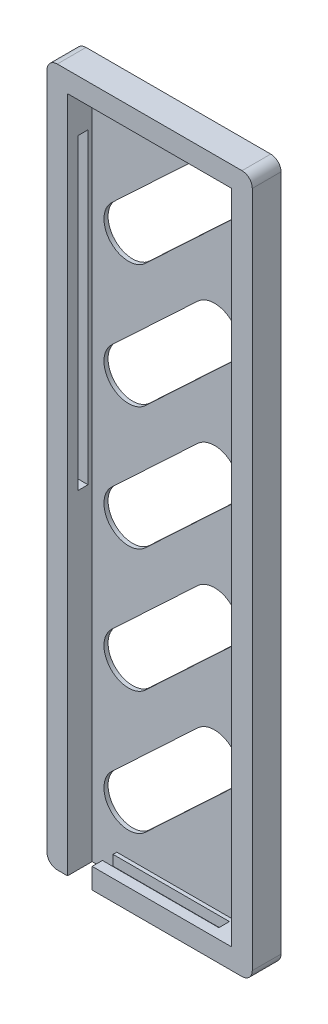
from build123d import *

# Parameters (mm, degrees)
SKETCH_1_W           = 10
SKETCH_1_H           = 34
EXTRUDE_2_DEPTH      = 1.4
SKETCH_2_W           = 8
SKETCH_2_H           = 32
CUT_EXTRUDE_1_DEPTH  = 1.2
SKETCH_4_W           = 1.2
SKETCH_4_H           = 1
CUT_EXTRUDE_4_DEPTH  = 1.2
FILLET_1_R           = 0.5
FILLET_2_R           = 0.5
SKETCH_6_W           = 6.011424245
SKETCH_6_H           = 0.514664245
CUT_EXTRUDE_6_DEPTH  = 0.5
SKETCH_7_W           = 0.498386998
SKETCH_7_H           = 14.972688723
CUT_EXTRUDE_7_DEPTH  = 0.5
SKETCH_8_W           = 0.497690278
SKETCH_8_H           = 27.903913782
CUT_EXTRUDE_8_DEPTH  = 0.5
SKETCH_10_W          = 5.67106867
SKETCH_10_H          = 0.515598409
CUT_EXTRUDE_9_DEPTH  = 0.5
CUT_EXTRUDE_11_REACH = 22.554


with BuildPart() as part:
    # 草图1 → 凸台-拉伸2 (new body)
    with BuildSketch(Plane.XY):
        with Locations((3.178294574, 1.80536099)):
            Rectangle(SKETCH_1_W, SKETCH_1_H)
    extrude(amount=EXTRUDE_2_DEPTH)

    # 草图2 → 切除-拉伸1 (cut)
    with BuildSketch(Plane.XY.offset(1.4)):
        with Locations((3.178294574, 1.80536099)):
            Rectangle(SKETCH_2_W, SKETCH_2_H)
    extrude(amount=-CUT_EXTRUDE_1_DEPTH, mode=Mode.SUBTRACT)

    # 草图4 → 切除-拉伸4 (cut)
    with BuildSketch(Plane.XY.offset(1.4)):
        with Locations((-0.221705426, -14.69463901)):
            Rectangle(SKETCH_4_W, SKETCH_4_H)
    extrude(amount=-CUT_EXTRUDE_4_DEPTH, mode=Mode.SUBTRACT)

    # 圆角1
    fillet_1_edges = [part.edges().sort_by_distance(p)[0] for p in [
        (-1.821705426, -15.19463901, 0.7),
    ]]
    fillet(fillet_1_edges, radius=FILLET_1_R)

    # 圆角2
    fillet_2_edges = [part.edges().sort_by_distance(p)[0] for p in [
        (-1.821705426, 18.80536099, 0.7),
        (8.178294574, 18.80536099, 0.7),
        (8.178294574, -15.19463901, 0.7),
    ]]
    fillet(fillet_2_edges, radius=FILLET_2_R)

    # 草图6 → 切除-拉伸6 (cut)
    with BuildSketch(Plane.XZ.offset(-17.80536099)):
        with Locations((3.184006697, 0.642667877)):
            Rectangle(SKETCH_6_W, SKETCH_6_H)
    extrude(amount=-CUT_EXTRUDE_6_DEPTH, mode=Mode.SUBTRACT)

    # 草图7 → 切除-拉伸7 (cut)
    with BuildSketch(Plane(origin=(-0.821705426, 0, 0), x_dir=(0, 0, -1), z_dir=(1, 0, 0))):
        with Locations((-0.650806501, 8.293480481)):
            Rectangle(SKETCH_7_W, SKETCH_7_H)
    extrude(amount=-CUT_EXTRUDE_7_DEPTH, mode=Mode.SUBTRACT)

    # 草图8 → 切除-拉伸8 (cut)
    with BuildSketch(Plane.ZY.offset(-7.178294574)):
        with Locations((0.641533001, 1.822842427)):
            Rectangle(SKETCH_8_W, SKETCH_8_H)
    extrude(amount=-CUT_EXTRUDE_8_DEPTH, mode=Mode.SUBTRACT)

    # 草图10 → 切除-拉伸9 (cut)
    with BuildSketch(Plane(origin=(0, -14.19463901, 0), x_dir=(1, 0, 0), z_dir=(0, 1, 0))):
        with Locations((3.213828909, -0.642200795)):
            Rectangle(SKETCH_10_W, SKETCH_10_H)
    extrude(amount=-CUT_EXTRUDE_9_DEPTH, mode=Mode.SUBTRACT)

    # 草图11 → 切除-拉伸11 (cut, up to next)
    with BuildSketch(Plane(origin=(0, 0, 0), x_dir=(-1, 0, 0), z_dir=(0, 0, -1)), mode=Mode.PRIVATE) as cut_extrude_11_sk1:
        with BuildLine():
            Line((-4.31947378, 17.019101686), (-0.131341084, 13.086732818))
            ThreePointArc((-0.131341084, 13.086732818), (-0.078041772, 11.394479644), (-1.770294947, 11.341180331))
            Line((-1.770294947, 11.341180331), (-5.958427643, 15.273549198))
            ThreePointArc((-5.958427643, 15.273549198), (-6.011726955, 16.965802373), (-4.31947378, 17.019101686))
        make_face()
    cut_extrude_11_tool1 = extrude(cut_extrude_11_sk1.sketch, amount=-CUT_EXTRUDE_11_REACH, mode=Mode.PRIVATE) & part.part
    # 草图11 → 切除-拉伸11 (cut, up to next)
    with BuildSketch(Plane(origin=(0, 0, 0), x_dir=(-1, 0, 0), z_dir=(0, 0, -1)), mode=Mode.PRIVATE) as cut_extrude_11_sk2:
        with BuildLine():
            Line((-5.958427643, 9.273549198), (-1.770294947, 5.341180331))
            ThreePointArc((-1.770294947, 5.341180331), (-0.078041772, 5.394479644), (-0.131341084, 7.086732818))
            Line((-0.131341084, 7.086732818), (-4.31947378, 11.019101686))
            ThreePointArc((-4.31947378, 11.019101686), (-6.011726955, 10.965802373), (-5.958427643, 9.273549198))
        make_face()
    cut_extrude_11_tool2 = extrude(cut_extrude_11_sk2.sketch, amount=-CUT_EXTRUDE_11_REACH, mode=Mode.PRIVATE) & part.part
    # 草图11 → 切除-拉伸11 (cut, up to next)
    with BuildSketch(Plane(origin=(0, 0, 0), x_dir=(-1, 0, 0), z_dir=(0, 0, -1)), mode=Mode.PRIVATE) as cut_extrude_11_sk3:
        with BuildLine():
            Line((-5.958427643, 3.273549198), (-1.770294947, -0.658819669))
            ThreePointArc((-1.770294947, -0.658819669), (-0.078041772, -0.605520356), (-0.131341084, 1.086732818))
            Line((-0.131341084, 1.086732818), (-4.31947378, 5.019101686))
            ThreePointArc((-4.31947378, 5.019101686), (-6.011726955, 4.965802373), (-5.958427643, 3.273549198))
        make_face()
    cut_extrude_11_tool3 = extrude(cut_extrude_11_sk3.sketch, amount=-CUT_EXTRUDE_11_REACH, mode=Mode.PRIVATE) & part.part
    # 草图11 → 切除-拉伸11 (cut, up to next)
    with BuildSketch(Plane(origin=(0, 0, 0), x_dir=(-1, 0, 0), z_dir=(0, 0, -1)), mode=Mode.PRIVATE) as cut_extrude_11_sk4:
        with BuildLine():
            Line((-5.958427643, -2.726450802), (-1.770294947, -6.658819669))
            ThreePointArc((-1.770294947, -6.658819669), (-0.078041772, -6.605520356), (-0.131341084, -4.913267182))
            Line((-0.131341084, -4.913267182), (-4.31947378, -0.980898314))
            ThreePointArc((-4.31947378, -0.980898314), (-6.011726955, -1.034197627), (-5.958427643, -2.726450802))
        make_face()
    cut_extrude_11_tool4 = extrude(cut_extrude_11_sk4.sketch, amount=-CUT_EXTRUDE_11_REACH, mode=Mode.PRIVATE) & part.part
    # 草图11 → 切除-拉伸11 (cut, up to next)
    with BuildSketch(Plane(origin=(0, 0, 0), x_dir=(-1, 0, 0), z_dir=(0, 0, -1)), mode=Mode.PRIVATE) as cut_extrude_11_sk5:
        with BuildLine():
            Line((-5.958427643, -8.726450802), (-1.770294947, -12.658819669))
            ThreePointArc((-1.770294947, -12.658819669), (-0.078041772, -12.605520356), (-0.131341084, -10.913267182))
            Line((-0.131341084, -10.913267182), (-4.31947378, -6.980898314))
            ThreePointArc((-4.31947378, -6.980898314), (-6.011726955, -7.034197627), (-5.958427643, -8.726450802))
        make_face()
    cut_extrude_11_tool5 = extrude(cut_extrude_11_sk5.sketch, amount=-CUT_EXTRUDE_11_REACH, mode=Mode.PRIVATE) & part.part
    add(cut_extrude_11_tool1.solids().sort_by_distance((3.044884, 14.180141, 0))[0], mode=Mode.SUBTRACT)
    add(cut_extrude_11_tool2.solids().sort_by_distance((3.044884, 8.180141, 0))[0], mode=Mode.SUBTRACT)
    add(cut_extrude_11_tool3.solids().sort_by_distance((3.044884, 2.180141, 0))[0], mode=Mode.SUBTRACT)
    add(cut_extrude_11_tool4.solids().sort_by_distance((3.044884, -3.819859, 0))[0], mode=Mode.SUBTRACT)
    add(cut_extrude_11_tool5.solids().sort_by_distance((3.044884, -9.819859, 0))[0], mode=Mode.SUBTRACT)


solid = part.part
